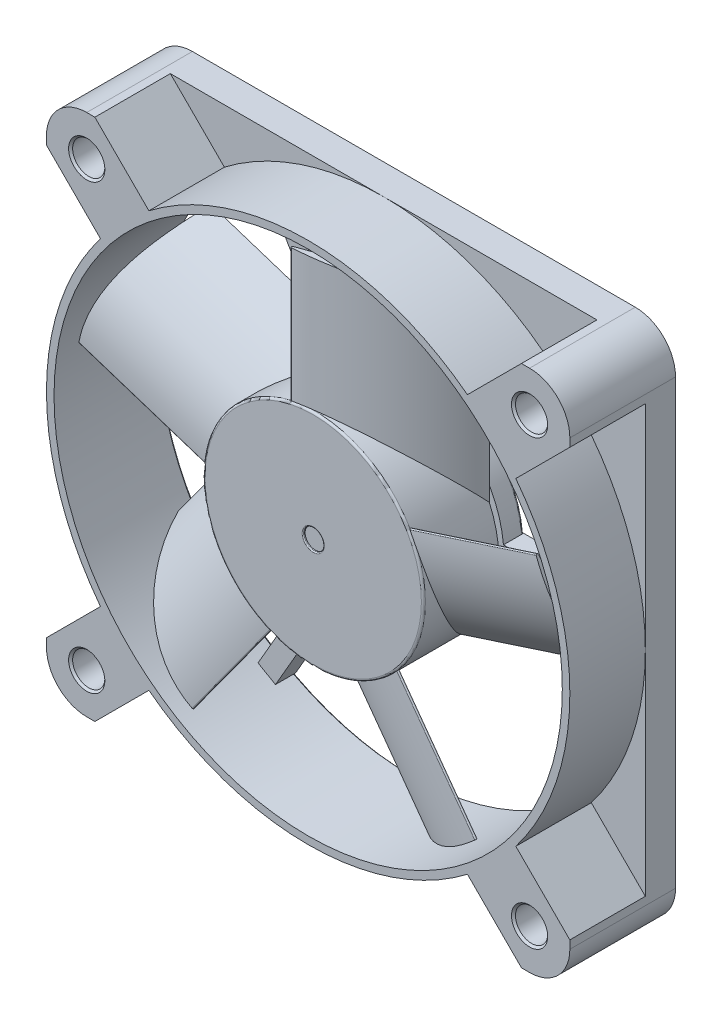
from build123d import *

# Parameters (mm, degrees)
SKETCH_1_R               = 10.95
EXTRUDE_1_DEPTH          = 7.5
FILLET_1_R               = 0.2
SKETCH_2_R               = 1
CUT_EXTRUDE_1_DEPTH      = 0.2
FILLET_2_R               = 0.1
EXTRUDE_2_REACH          = 40.322
EXTRUDE_2_END_RADIUS     = 10.95
PATTERN_CIRCULAR_1_COUNT = 5
SKETCH_5_OUTSIDE_W       = 67.954
SKETCH_5_OUTSIDE_H       = 67.675
SKETCH_5_OUTSIDE_R       = 24
CUT_EXTRUDE_2_DEPTH      = 39.202674989
EXTRUDE_START            = 2
SKETCH_6_R               = 10.95
EXTRUDE_3_DEPTH          = 2
FILLET_3_R               = 0.2
SKETCH_7_R               = 26
SKETCH_7_R_2             = 25.25
EXTRUDE_4_DEPTH          = 10.5
EXTRUDE_7_DEPTH          = 3
EXTRUDE_8_DEPTH          = 10.5
PATTERN_CIRCULAR_2_COUNT = 4
SKETCH_12_R              = 1.6
CUT_EXTRUDE_3_DEPTH      = 39.23937761
EXTRUDE_9_DEPTH          = 2
CHAMFER_1_SIZE           = 0.2


with BuildPart() as part:
    # Эскиз1 → Вытянуть1 (new body)
    with BuildSketch(Plane.XY):
        Circle(SKETCH_1_R)
    extrude(amount=EXTRUDE_1_DEPTH)

    # Скругление1
    fillet_1_edges = [part.edges().sort_by_distance(p)[0] for p in [
        (-10.95, 0, 7.5),
    ]]
    fillet(fillet_1_edges, radius=FILLET_1_R)

    # Эскиз2 → Вырез-Вытянуть1 (cut)
    with BuildSketch(Plane.XY.offset(7.5)):
        Circle(SKETCH_2_R)
    extrude(amount=-CUT_EXTRUDE_1_DEPTH, mode=Mode.SUBTRACT)

    # Скругление2
    fillet_2_edges = [part.edges().sort_by_distance(p)[0] for p in [
        (-1, 0, 7.5),
    ]]
    fillet(fillet_2_edges, radius=FILLET_2_R)

    # Вытянуть2: up to this cylinder (the profile starts outside it)
    extrude_2_end = Plane(origin=(0, 0, 4.8728), z_dir=(0, 0, -1)) * Cylinder(EXTRUDE_2_END_RADIUS, 103.544, mode=Mode.PRIVATE)
    # Эскиз3 → Вытянуть2 (add, up to the surface)
    with BuildSketch(Plane(origin=(0, 25, 0), x_dir=(-1, 0, 0), z_dir=(0, 1, 0)), mode=Mode.PRIVATE) as extrude_2_sk1:
        with BuildLine():
            ThreePointArc((2.29556634, 7.350715479), (-4.956057807, 5.52175623), (-10, 0))
            ThreePointArc((-10, 0), (-4.386066613, 4.510974806), (2.313415481, 7.153337661))
            ThreePointArc((2.313415481, 7.153337661), (2.390691067, 7.259821766), (2.29556634, 7.350715479))
        make_face()
    extrude_2_tool1 = extrude(extrude_2_sk1.sketch, amount=-EXTRUDE_2_REACH, mode=Mode.PRIVATE) - extrude_2_end
    extrude_2 = extrude_2_tool1.solids().sort_by_distance((4.225609, 25, 4.8728))[0]
    add(extrude_2)

    # Круговой массив1: Вытянуть2 ×5 about axis
    pattern_circular_1_axis = Axis((0, 0, 0), (0, 0, 1))
    for i in range(1, PATTERN_CIRCULAR_1_COUNT):
        add(extrude_2.rotate(pattern_circular_1_axis, i * 360 / PATTERN_CIRCULAR_1_COUNT))

    # Эскиз5 outside → Вырез-Вытянуть2 (cut, through all)
    with BuildSketch(Plane.XY.offset(7.5)):
        with Locations((1.176, -0.5515)):
            Rectangle(SKETCH_5_OUTSIDE_W, SKETCH_5_OUTSIDE_H)
        Circle(SKETCH_5_OUTSIDE_R, mode=Mode.SUBTRACT)
    extrude(amount=-CUT_EXTRUDE_2_DEPTH, mode=Mode.SUBTRACT)


with BuildPart() as body_2:
    # Эскиз6 → Вытянуть3 (new body)
    with BuildSketch(Plane(origin=(0, 0, -0.5), x_dir=(-1, 0, 0), z_dir=(0, 0, -1)).offset(EXTRUDE_START)):
        Circle(SKETCH_6_R)
    extrude(amount=-EXTRUDE_3_DEPTH)

    # Скругление3
    fillet_3_edges = [body_2.edges().sort_by_distance(p)[0] for p in [
        (10.95, 0, -2.5),
    ]]
    fillet(fillet_3_edges, radius=FILLET_3_R)

    # Эскиз13 → Вытянуть9 (add)
    with BuildSketch(Plane(origin=(0, 0, -2.5), x_dir=(-1, 0, 0), z_dir=(0, 0, -1))):
        with BuildLine():
            Line((-25.230190249, -1), (-10.703387314, -1))
            ThreePointArc((-10.703387314, -1), (-10.75, 0), (-10.703387314, 1))
            Line((-10.703387314, 1), (-25.230190249, 1))
            Line((-25.230190249, 1), (-25.230190249, -1))
        make_face()
        with BuildLine():
            Line((11.749069721, 22.349985698), (4.485668253, 9.769405321))
            ThreePointArc((4.485668253, 9.769405321), (5.375, 9.309773091), (6.217719061, 8.769405321))
            Line((6.217719061, 8.769405321), (13.481120528, 21.349985698))
            Line((13.481120528, 21.349985698), (11.749069721, 22.349985698))
        make_face()
        with BuildLine():
            ThreePointArc((6.217719061, -8.769405321), (5.375, -9.309773091), (4.485668253, -9.769405321))
            Line((4.485668253, -9.769405321), (11.749069721, -22.349985698))
            Line((11.749069721, -22.349985698), (13.481120528, -21.349985698))
            Line((13.481120528, -21.349985698), (6.217719061, -8.769405321))
        make_face()
    extrude(amount=-EXTRUDE_9_DEPTH)


with BuildPart() as body_3:
    # Эскиз7 → Вытянуть4 (new body)
    with BuildSketch(Plane(origin=(0, 0, -2.5), x_dir=(-1, 0, 0), z_dir=(0, 0, -1))):
        Circle(SKETCH_7_R)
        Circle(SKETCH_7_R_2, mode=Mode.SUBTRACT)
    extrude(amount=-EXTRUDE_4_DEPTH)

    # Эскиз8 → Вытянуть7 (add)
    with BuildSketch(Plane(origin=(0, 0, -2.5), x_dir=(-1, 0, 0), z_dir=(0, 0, -1))):
        with BuildLine():
            ThreePointArc((-2.7e-08, -26), (-18.384776312, -18.384776309), (-26, -2.3e-08))
            Line((-26, -2.3e-08), (-26, -22))
            ThreePointArc((-26, -22), (-24.828427125, -24.828427125), (-22, -26))
            Line((-22, -26), (-2.7e-08, -26))
        make_face()
        with BuildLine():
            Line((26, -22), (26, 0))
            ThreePointArc((26, 0), (18.384776301, -18.38477632), (-2.7e-08, -26))
            Line((-2.7e-08, -26), (22, -26))
            ThreePointArc((22, -26), (24.828427125, -24.828427125), (26, -22))
        make_face()
        with BuildLine():
            Line((22, 26), (-1.9e-08, 26))
            ThreePointArc((-1.9e-08, 26), (18.384776304, 18.384776318), (26, 0))
            Line((26, 0), (26, 22))
            ThreePointArc((26, 22), (24.828427125, 24.828427125), (22, 26))
        make_face()
        with BuildLine():
            Line((-1.9e-08, 26), (-22, 26))
            ThreePointArc((-22, 26), (-24.828427125, 24.828427125), (-26, 22))
            Line((-26, 22), (-26, -2.3e-08))
            ThreePointArc((-26, -2.3e-08), (-18.384776326, 18.384776296), (-1.9e-08, 26))
        make_face()
    extrude(amount=-EXTRUDE_7_DEPTH)

    # Эскиз11 → Вытянуть8 (add)
    with BuildSketch(Plane(origin=(0, 0, -2.5), x_dir=(-1, 0, 0), z_dir=(0, 0, -1))):
        with BuildLine():
            Line((15.287678284, 20.096004396), (21.191673888, 26))
            Line((21.191673888, 26), (22, 26))
            ThreePointArc((22, 26), (24.828427125, 24.828427125), (26, 22))
            Line((26, 22), (26, 21.191673888))
            Line((26, 21.191673888), (20.096004396, 15.287678284))
            ThreePointArc((20.096004396, 15.287678284), (17.854446225, 17.854446225), (15.287678284, 20.096004396))
        make_face()
    extrude_8 = extrude(amount=-EXTRUDE_8_DEPTH)

    # Круговой массив2: Вытянуть8 ×4 about axis
    pattern_circular_2_axis = Axis((0, 0, 0), (0, 0, 1))
    for i in range(1, PATTERN_CIRCULAR_2_COUNT):
        add(extrude_8.rotate(pattern_circular_2_axis, i * 360 / PATTERN_CIRCULAR_2_COUNT))

    # Эскиз12 → Вырез-Вытянуть3 (cut, through all)
    with BuildSketch(Plane(origin=(0, 0, -2.5), x_dir=(-1, 0, 0), z_dir=(0, 0, -1))):
        with Locations((22, -22)):
            Circle(SKETCH_12_R)
        with Locations((22, 22)):
            Circle(SKETCH_12_R)
        with Locations((-22, 22)):
            Circle(SKETCH_12_R)
        with Locations((-22, -22)):
            Circle(SKETCH_12_R)
    extrude(amount=-CUT_EXTRUDE_3_DEPTH, mode=Mode.SUBTRACT)

    # Фаска1
    chamfer_1_edges = [body_3.edges().sort_by_distance(p)[0] for p in [
        (-20.4, -22, 8),
        (-20.4, -22, -2.5),
        (-20.4, 22, 8),
        (-20.4, 22, -2.5),
        (23.6, 22, 8),
        (23.6, 22, -2.5),
        (23.6, -22, 8),
        (23.6, -22, -2.5),
        (8.066547868, 23.926832333, -2.5),
    ]]
    chamfer(chamfer_1_edges, length=CHAMFER_1_SIZE)


solid = Compound([part.part, body_2.part, body_3.part])
